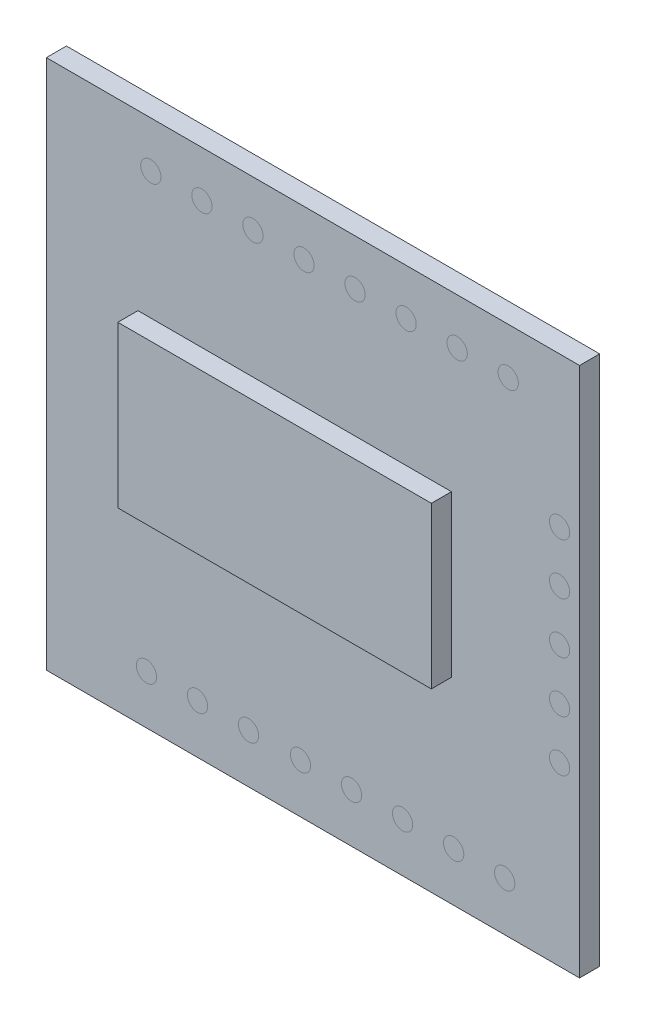
from build123d import *

# Parameters (mm, degrees)
SKETCH1_W              = 26.530820631
SKETCH1_H              = 26.394972577
BOSS_EXTRUDE1_DEPTH    = 1
SKETCH1_4_R            = 0.505
CUT_EXTRUDE1_DEPTH     = 1
SKETCH1_3_R            = 0.505
BOSS_EXTRUDE2_DEPTH    = 1
BOSS_EXTRUDE2_2_DEPTH  = 1
BOSS_EXTRUDE2_3_DEPTH  = 1
BOSS_EXTRUDE2_4_DEPTH  = 1
BOSS_EXTRUDE2_5_DEPTH  = 1
BOSS_EXTRUDE2_6_DEPTH  = 1
BOSS_EXTRUDE2_7_DEPTH  = 1
BOSS_EXTRUDE2_8_DEPTH  = 1
BOSS_EXTRUDE2_9_DEPTH  = 1
BOSS_EXTRUDE2_10_DEPTH = 1
BOSS_EXTRUDE2_11_DEPTH = 1
BOSS_EXTRUDE2_12_DEPTH = 1
BOSS_EXTRUDE2_13_DEPTH = 1
BOSS_EXTRUDE2_14_DEPTH = 1
BOSS_EXTRUDE2_15_DEPTH = 1
BOSS_EXTRUDE2_16_DEPTH = 1
BOSS_EXTRUDE2_17_DEPTH = 1
BOSS_EXTRUDE2_18_DEPTH = 1
BOSS_EXTRUDE2_19_DEPTH = 1
BOSS_EXTRUDE2_20_DEPTH = 1
BOSS_EXTRUDE2_21_DEPTH = 1
SKETCH1_5_W            = 15.6
SKETCH1_5_H            = 8
BOSS_EXTRUDE3_DEPTH    = 1


with BuildPart() as part:
    # Sketch1 → Boss-Extrude1 (new body)
    with BuildSketch(Plane.XY):
        with Locations((0.908737179, -0.571736137)):
            Rectangle(SKETCH1_W, SKETCH1_H)
    extrude(amount=-BOSS_EXTRUDE1_DEPTH)

    # Sketch1<4> → Cut-Extrude1 (cut)
    with BuildSketch(Plane.XY):
        with Locations((13.18, 5.165525757)):
            Circle(SKETCH1_4_R)
        with Locations((13.18, 2.625525757)):
            Circle(SKETCH1_4_R)
        with Locations((13.18, 0.085525757)):
            Circle(SKETCH1_4_R)
        with Locations((13.18, -2.454474243)):
            Circle(SKETCH1_4_R)
        with Locations((13.18, -4.994474243)):
            Circle(SKETCH1_4_R)
        with Locations((-7.374476083, -11.324983341)):
            Circle(SKETCH1_4_R)
        with Locations((-4.834476083, -11.324983341)):
            Circle(SKETCH1_4_R)
        with Locations((-2.294476083, -11.324983341)):
            Circle(SKETCH1_4_R)
        with Locations((0.289453775, -11.324983341)):
            Circle(SKETCH1_4_R)
        with Locations((2.829453775, -11.324983341)):
            Circle(SKETCH1_4_R)
        with Locations((5.369453775, -11.324983341)):
            Circle(SKETCH1_4_R)
        with Locations((7.909453775, -11.324983341)):
            Circle(SKETCH1_4_R)
        with Locations((10.449453775, -11.324983341)):
            Circle(SKETCH1_4_R)
        with Locations((-7.156488425, 10.328476252)):
            Circle(SKETCH1_4_R)
        with Locations((-4.616488425, 10.328476252)):
            Circle(SKETCH1_4_R)
        with Locations((-2.076488425, 10.328476252)):
            Circle(SKETCH1_4_R)
        with Locations((0.463511575, 10.328476252)):
            Circle(SKETCH1_4_R)
        with Locations((3.003511575, 10.328476252)):
            Circle(SKETCH1_4_R)
        with Locations((5.543511575, 10.328476252)):
            Circle(SKETCH1_4_R)
        with Locations((8.083511575, 10.328476252)):
            Circle(SKETCH1_4_R)
        with Locations((10.623511575, 10.328476252)):
            Circle(SKETCH1_4_R)
    extrude(amount=-CUT_EXTRUDE1_DEPTH, mode=Mode.SUBTRACT)

    # Sketch1<5> → Boss-Extrude3 (add)
    with BuildSketch(Plane.XY):
        Rectangle(SKETCH1_5_W, SKETCH1_5_H)
    extrude(amount=BOSS_EXTRUDE3_DEPTH)


with BuildPart() as body_2:
    # Sketch1<3> → Boss-Extrude2 (new body)
    with BuildSketch(Plane.XY):
        with Locations((13.18, 5.165525757)):
            Circle(SKETCH1_3_R)
    extrude(amount=-BOSS_EXTRUDE2_DEPTH)


with BuildPart() as body_3:
    # Sketch1<3> → Boss-Extrude2 2 (new body)
    with BuildSketch(Plane.XY):
        with Locations((13.18, 2.625525757)):
            Circle(SKETCH1_3_R)
    extrude(amount=-BOSS_EXTRUDE2_2_DEPTH)


with BuildPart() as body_4:
    # Sketch1<3> → Boss-Extrude2 3 (new body)
    with BuildSketch(Plane.XY):
        with Locations((13.18, 0.085525757)):
            Circle(SKETCH1_3_R)
    extrude(amount=-BOSS_EXTRUDE2_3_DEPTH)


with BuildPart() as body_5:
    # Sketch1<3> → Boss-Extrude2 4 (new body)
    with BuildSketch(Plane.XY):
        with Locations((13.18, -2.454474243)):
            Circle(SKETCH1_3_R)
    extrude(amount=-BOSS_EXTRUDE2_4_DEPTH)


with BuildPart() as body_6:
    # Sketch1<3> → Boss-Extrude2 5 (new body)
    with BuildSketch(Plane.XY):
        with Locations((13.18, -4.994474243)):
            Circle(SKETCH1_3_R)
    extrude(amount=-BOSS_EXTRUDE2_5_DEPTH)


with BuildPart() as body_7:
    # Sketch1<3> → Boss-Extrude2 6 (new body)
    with BuildSketch(Plane.XY):
        with Locations((-7.374476083, -11.324983341)):
            Circle(SKETCH1_3_R)
    extrude(amount=-BOSS_EXTRUDE2_6_DEPTH)


with BuildPart() as body_8:
    # Sketch1<3> → Boss-Extrude2 7 (new body)
    with BuildSketch(Plane.XY):
        with Locations((-4.834476083, -11.324983341)):
            Circle(SKETCH1_3_R)
    extrude(amount=-BOSS_EXTRUDE2_7_DEPTH)


with BuildPart() as body_9:
    # Sketch1<3> → Boss-Extrude2 8 (new body)
    with BuildSketch(Plane.XY):
        with Locations((-2.294476083, -11.324983341)):
            Circle(SKETCH1_3_R)
    extrude(amount=-BOSS_EXTRUDE2_8_DEPTH)


with BuildPart() as body_10:
    # Sketch1<3> → Boss-Extrude2 9 (new body)
    with BuildSketch(Plane.XY):
        with Locations((0.289453775, -11.324983341)):
            Circle(SKETCH1_3_R)
    extrude(amount=-BOSS_EXTRUDE2_9_DEPTH)


with BuildPart() as body_11:
    # Sketch1<3> → Boss-Extrude2 10 (new body)
    with BuildSketch(Plane.XY):
        with Locations((2.829453775, -11.324983341)):
            Circle(SKETCH1_3_R)
    extrude(amount=-BOSS_EXTRUDE2_10_DEPTH)


with BuildPart() as body_12:
    # Sketch1<3> → Boss-Extrude2 11 (new body)
    with BuildSketch(Plane.XY):
        with Locations((5.369453775, -11.324983341)):
            Circle(SKETCH1_3_R)
    extrude(amount=-BOSS_EXTRUDE2_11_DEPTH)


with BuildPart() as body_13:
    # Sketch1<3> → Boss-Extrude2 12 (new body)
    with BuildSketch(Plane.XY):
        with Locations((7.909453775, -11.324983341)):
            Circle(SKETCH1_3_R)
    extrude(amount=-BOSS_EXTRUDE2_12_DEPTH)


with BuildPart() as body_14:
    # Sketch1<3> → Boss-Extrude2 13 (new body)
    with BuildSketch(Plane.XY):
        with Locations((10.449453775, -11.324983341)):
            Circle(SKETCH1_3_R)
    extrude(amount=-BOSS_EXTRUDE2_13_DEPTH)


with BuildPart() as body_15:
    # Sketch1<3> → Boss-Extrude2 14 (new body)
    with BuildSketch(Plane.XY):
        with Locations((-7.156488425, 10.328476252)):
            Circle(SKETCH1_3_R)
    extrude(amount=-BOSS_EXTRUDE2_14_DEPTH)


with BuildPart() as body_16:
    # Sketch1<3> → Boss-Extrude2 15 (new body)
    with BuildSketch(Plane.XY):
        with Locations((-4.616488425, 10.328476252)):
            Circle(SKETCH1_3_R)
    extrude(amount=-BOSS_EXTRUDE2_15_DEPTH)


with BuildPart() as body_17:
    # Sketch1<3> → Boss-Extrude2 16 (new body)
    with BuildSketch(Plane.XY):
        with Locations((-2.076488425, 10.328476252)):
            Circle(SKETCH1_3_R)
    extrude(amount=-BOSS_EXTRUDE2_16_DEPTH)


with BuildPart() as body_18:
    # Sketch1<3> → Boss-Extrude2 17 (new body)
    with BuildSketch(Plane.XY):
        with Locations((0.463511575, 10.328476252)):
            Circle(SKETCH1_3_R)
    extrude(amount=-BOSS_EXTRUDE2_17_DEPTH)


with BuildPart() as body_19:
    # Sketch1<3> → Boss-Extrude2 18 (new body)
    with BuildSketch(Plane.XY):
        with Locations((3.003511575, 10.328476252)):
            Circle(SKETCH1_3_R)
    extrude(amount=-BOSS_EXTRUDE2_18_DEPTH)


with BuildPart() as body_20:
    # Sketch1<3> → Boss-Extrude2 19 (new body)
    with BuildSketch(Plane.XY):
        with Locations((5.543511575, 10.328476252)):
            Circle(SKETCH1_3_R)
    extrude(amount=-BOSS_EXTRUDE2_19_DEPTH)


with BuildPart() as body_21:
    # Sketch1<3> → Boss-Extrude2 20 (new body)
    with BuildSketch(Plane.XY):
        with Locations((8.083511575, 10.328476252)):
            Circle(SKETCH1_3_R)
    extrude(amount=-BOSS_EXTRUDE2_20_DEPTH)


with BuildPart() as body_22:
    # Sketch1<3> → Boss-Extrude2 21 (new body)
    with BuildSketch(Plane.XY):
        with Locations((10.623511575, 10.328476252)):
            Circle(SKETCH1_3_R)
    extrude(amount=-BOSS_EXTRUDE2_21_DEPTH)


solid = Compound([part.part, body_2.part, body_3.part, body_4.part, body_5.part, body_6.part, body_7.part, body_8.part, body_9.part, body_10.part, body_11.part, body_12.part, body_13.part, body_14.part, body_15.part, body_16.part, body_17.part, body_18.part, body_19.part, body_20.part, body_21.part, body_22.part])
